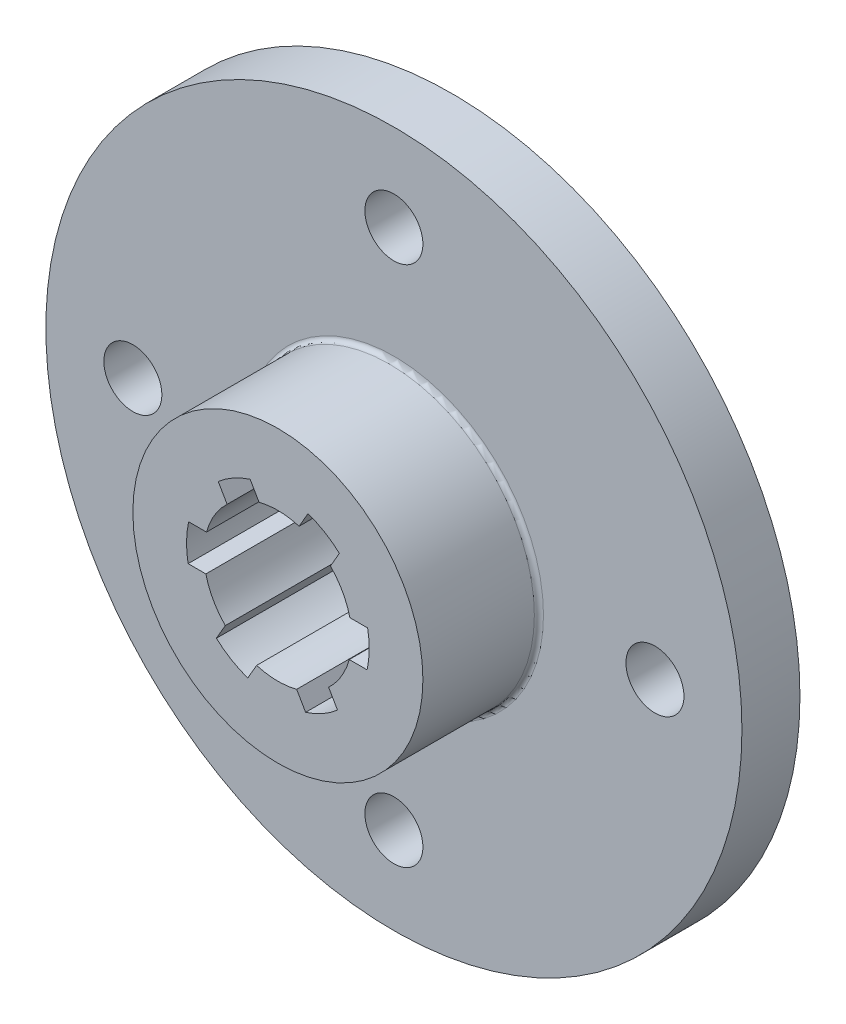
from build123d import *

# Parameters (mm, degrees)
SKETCH1_W           = 38.1
SKETCH1_H           = 6.35
SKETCH2_R           = 15.875
BOSS_EXTRUDE1_DEPTH = 12.7
CUT_EXTRUDE1_DEPTH  = 14.986
HOLE1_D             = 6.35
SKETCH10_R          = 4
CUT_EXTRUDE3_DEPTH  = 10
FILLET2_R           = 0.5


with BuildPart() as part:
    # Sketch1 → Revolve1 (revolve)
    with BuildSketch(Plane(origin=(0, 0, 0), x_dir=(1, 0, 0), z_dir=(0, 1, 0))):
        with Locations((19.05, 0)):
            Rectangle(SKETCH1_W, SKETCH1_H)
    revolve(axis=Axis((0, 0, -3.175), (0, 0, 1)))

    # Sketch2 → Boss-Extrude1 (add)
    with BuildSketch(Plane.XY.offset(3.175)):
        Circle(SKETCH2_R)
    extrude(amount=BOSS_EXTRUDE1_DEPTH)

    # Sketch3 → Cut-Extrude1 (cut)
    with BuildSketch(Plane.XY.offset(15.875)):
        with BuildLine():
            Line((-7.813605563, 2.134846154), (-9.769464259, 2.134846154))
            ThreePointArc((-9.769464259, 2.134846154), (-9.999052891, 0.137627323), (-9.824520402, -1.865153846))
            Line((-9.824520402, -1.865153846), (-7.882334751, -1.865153846))
            ThreePointArc((-7.882334751, -1.865153846), (-7.083348537, -3.928889601), (-5.755633784, -5.699357836))
            Line((-5.755633784, -5.699357836), (-6.733563132, -7.393181152))
            ThreePointArc((-6.733563132, -7.393181152), (-5.118715203, -8.590620156), (-3.296989588, -9.440861171))
            Line((-3.296989588, -9.440861171), (-2.325896763, -7.758879059))
            ThreePointArc((-2.325896763, -7.758879059), (-0.139156065, -8.098804578), (2.057971779, -7.83420399))
            Line((2.057971779, -7.83420399), (3.035901127, -9.528027306))
            ThreePointArc((3.035901127, -9.528027306), (4.880337688, -8.728247479), (6.527530814, -7.575707325))
            Line((6.527530814, -7.575707325), (5.556437988, -5.893725213))
            ThreePointArc((5.556437988, -5.893725213), (6.944192472, -4.169914977), (7.813605563, -2.134846154))
            Line((7.813605563, -2.134846154), (9.769464259, -2.134846154))
            ThreePointArc((9.769464259, -2.134846154), (9.999052891, -0.137627323), (9.824520402, 1.865153846))
            Line((9.824520402, 1.865153846), (7.882334751, 1.865153846))
            ThreePointArc((7.882334751, 1.865153846), (7.083348537, 3.928889601), (5.755633784, 5.699357836))
            Line((5.755633784, 5.699357836), (6.733563132, 7.393181152))
            ThreePointArc((6.733563132, 7.393181152), (5.118715203, 8.590620156), (3.296989588, 9.440861171))
            Line((3.296989588, 9.440861171), (2.325896763, 7.758879059))
            ThreePointArc((2.325896763, 7.758879059), (0.139156065, 8.098804578), (-2.057971779, 7.83420399))
            Line((-2.057971779, 7.83420399), (-3.035901127, 9.528027306))
            ThreePointArc((-3.035901127, 9.528027306), (-4.880337688, 8.728247479), (-6.527530814, 7.575707325))
            Line((-6.527530814, 7.575707325), (-5.556437988, 5.893725213))
            ThreePointArc((-5.556437988, 5.893725213), (-6.944192472, 4.169914977), (-7.813605563, 2.134846154))
        make_face()
    extrude(amount=-CUT_EXTRUDE1_DEPTH, mode=Mode.SUBTRACT)

    # Hole1 (through all)
    with Locations(Plane(origin=(0, 0, -3.175), x_dir=(-1, 0, 0), z_dir=(0, 0, -1))):
        with Locations((0, 28.575), (-28.575, 0), (28.575, 0), (0, -28.575)):
            Hole(HOLE1_D / 2)

    # Sketch10 → Cut-Extrude3 (cut)
    with BuildSketch(Plane.XY.offset(0.889)):
        Circle(SKETCH10_R)
    extrude(amount=-CUT_EXTRUDE3_DEPTH, mode=Mode.SUBTRACT)

    # Fillet2
    fillet2_edges = [part.edges().sort_by_distance(p)[0] for p in [
        (-15.875, 0, 3.175),
    ]]
    fillet(fillet2_edges, radius=FILLET2_R)


solid = part.part
